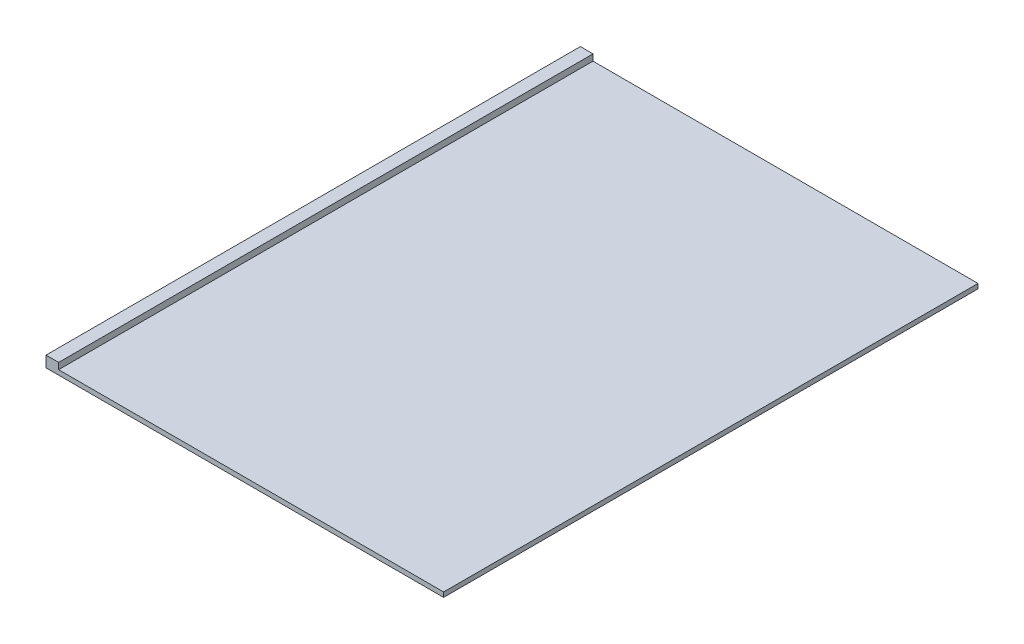
from build123d import *

# Parameters (mm, degrees)
SCHIZZO1_W               = 94.5
SCHIZZO1_H               = 127
COPERCHIO_DEPTH          = 1.125
SCHIZZO3_W               = 3
SCHIZZO3_H               = 127
INCASTRO_COPERCHIO_DEPTH = 1.5


with BuildPart() as part:
    # Schizzo1 → Coperchio (new body)
    with BuildSketch(Plane(origin=(0, 0, 0), x_dir=(1, 0, 0), z_dir=(0, 1, 0))):
        with Locations((47.25, 63.5)):
            Rectangle(SCHIZZO1_W, SCHIZZO1_H)
    extrude(amount=COPERCHIO_DEPTH)

    # Schizzo3 → Incastro coperchio (add)
    with BuildSketch(Plane(origin=(0, 1.125, 0), x_dir=(1, 0, 0), z_dir=(0, 1, 0))):
        with Locations((1.5, 63.5)):
            Rectangle(SCHIZZO3_W, SCHIZZO3_H)
    extrude(amount=INCASTRO_COPERCHIO_DEPTH)


solid = part.part
